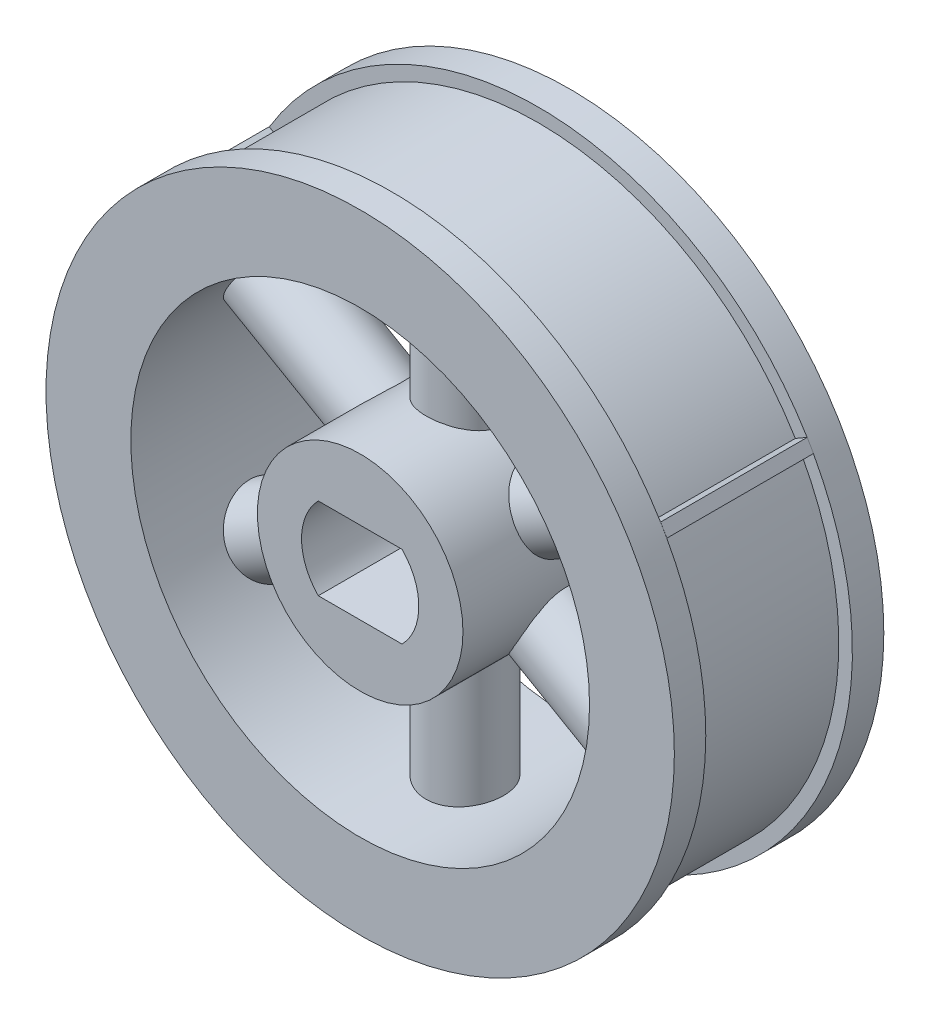
from build123d import *

# Parameters (mm, degrees)
SKETCH2_R           = 4.90735859
SKETCH2_R_2         = 2.8
BOSS_EXTRUDE1_DEPTH = 10
SKETCH3_R           = 14.35
SKETCH3_R_2         = 10.950119173
BOSS_EXTRUDE2_DEPTH = 10
SKETCH4_R           = 15
SKETCH4_R_2         = 14.35
BOSS_EXTRUDE3_DEPTH = 1.5
SKETCH5_R           = 15
SKETCH5_R_2         = 14.35
BOSS_EXTRUDE4_DEPTH = 1.5
BOSS_EXTRUDE5_DEPTH = 8.5
CIRPATTERN1_COUNT   = 6
SKETCH8_W           = 0.598057902
SKETCH8_H           = 0.656231918
BOSS_EXTRUDE6_DEPTH = 7
CIRPATTERN2_COUNT   = 3


with BuildPart() as part:
    # Sketch2 → Boss-Extrude1 (new body)
    # profile 1 of 3: a face of its own
    with BuildSketch(Plane.XY):
        Circle(SKETCH2_R)
        Circle(SKETCH2_R_2, mode=Mode.SUBTRACT)
    # profile 2 of 3: a face of its own
    with BuildSketch(Plane.XY):
        with BuildLine():
            Line((2, -1.959591794), (-2, -1.959591794))
            ThreePointArc((-2, -1.959591794), (0, -2.8), (2, -1.959591794))
        make_face()
    # profile 3 of 3: a face of its own
    with BuildSketch(Plane.XY):
        with BuildLine():
            Line((-2, 1.959591794), (2, 1.959591794))
            ThreePointArc((2, 1.959591794), (0, 2.8), (-2, 1.959591794))
        make_face()
    extrude(amount=BOSS_EXTRUDE1_DEPTH)


with BuildPart() as body_2:
    # Sketch3 → Boss-Extrude2 (new body)
    with BuildSketch(Plane.XY):
        Circle(SKETCH3_R)
        Circle(SKETCH3_R_2, mode=Mode.SUBTRACT)
    extrude(amount=BOSS_EXTRUDE2_DEPTH)

    # Sketch4 → Boss-Extrude3 (add)
    with BuildSketch(Plane.XY):
        Circle(SKETCH4_R)
        Circle(SKETCH4_R_2, mode=Mode.SUBTRACT)
    extrude(amount=BOSS_EXTRUDE3_DEPTH)

    # Sketch5 → Boss-Extrude4 (add)
    with BuildSketch(Plane.XY.offset(10)):
        Circle(SKETCH5_R)
        Circle(SKETCH5_R_2, mode=Mode.SUBTRACT)
    extrude(amount=-BOSS_EXTRUDE4_DEPTH)

    # Sketch7 → Boss-Extrude5 (add)
    with BuildSketch(Plane(origin=(0, 2.959591794, 0), x_dir=(-1, 0, 0), z_dir=(0, -1, 0))):
        with BuildLine():
            ThreePointArc((1.854596747, -5), (1.311397936, -3.688602064), (0, -3.145403253))
            Line((0, -3.145403253), (0, -6.854596747))
            ThreePointArc((0, -6.854596747), (1.311397936, -6.311397936), (1.854596747, -5))
        make_face()
        with BuildLine():
            Line((0, -6.854596747), (0, -3.145403253))
            ThreePointArc((0, -3.145403253), (-1.854596747, -5), (0, -6.854596747))
        make_face()
    boss_extrude5 = extrude(amount=-BOSS_EXTRUDE5_DEPTH)

    # CirPattern1: Boss-Extrude5 ×6 about axis
    cirpattern1_axis = Axis((0, 0, 10), (0, 0, 1))
    for i in range(1, CIRPATTERN1_COUNT):
        add(boss_extrude5.rotate(cirpattern1_axis, i * 360 / CIRPATTERN1_COUNT))

    # Sketch8 → Boss-Extrude6 (add)
    with BuildSketch(Plane.XY.offset(1.5)):
        with Locations((0, -14.675)):
            Rectangle(SKETCH8_W, SKETCH8_H)
    boss_extrude6 = extrude(amount=BOSS_EXTRUDE6_DEPTH)

    # CirPattern2: Boss-Extrude6 ×3 about axis
    cirpattern2_axis = Axis((0, 0, 0), (0, 0, 1))
    for i in range(1, CIRPATTERN2_COUNT):
        add(boss_extrude6.rotate(cirpattern2_axis, i * 360 / CIRPATTERN2_COUNT))


solid = Compound([part.part, body_2.part])
